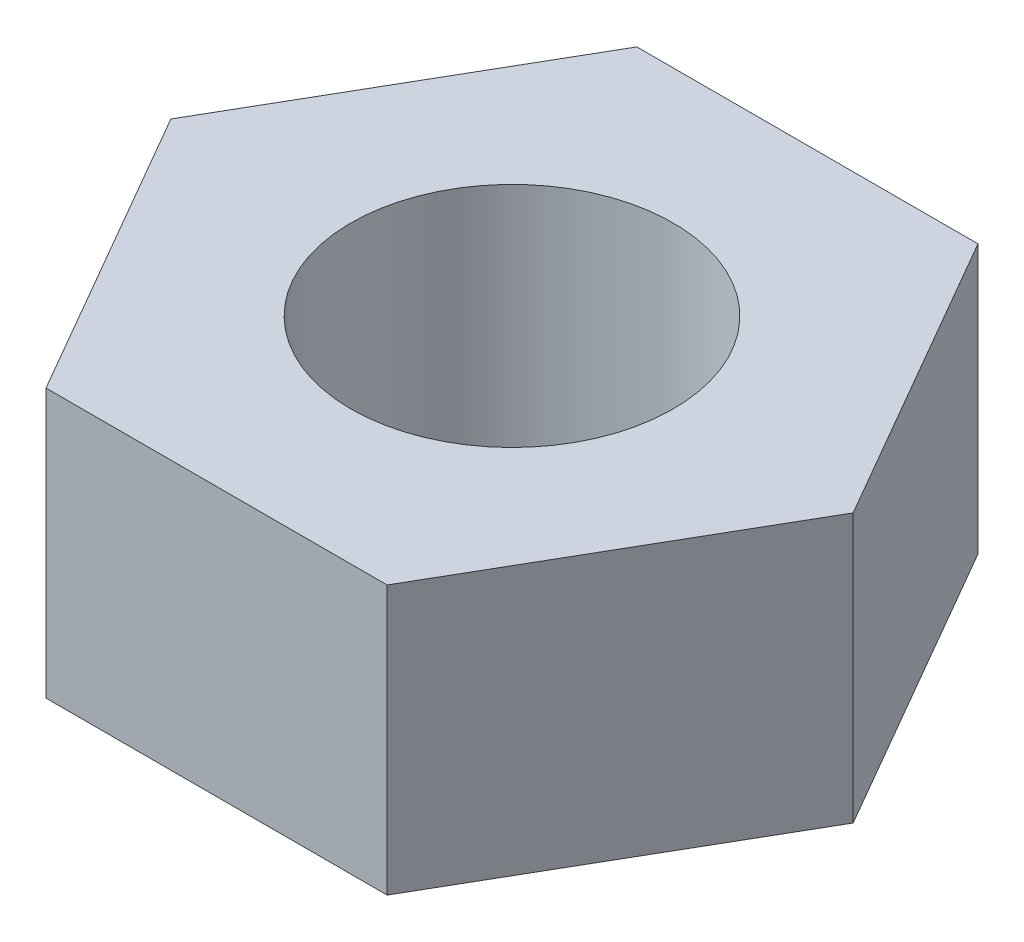
from build123d import *

# Parameters (mm, degrees)
SKETCH1_R           = 1.5
BOSS_EXTRUDE1_DEPTH = 1.25


with BuildPart() as part:
    # Sketch1 → Boss-Extrude1 (new, symmetric)
    with BuildSketch(Plane(origin=(0, 0, 0), x_dir=(1, 0, 0), z_dir=(0, 1, 0))):
        Polygon((1.58771324, 2.75), (-1.58771324, 2.75), (-3.175426481, 0), (-1.58771324, -2.75), (1.58771324, -2.75), (3.175426481, 0), align=None)
        with Locations(Location((0, 0, 0), (0, 0, 270))):
            Circle(SKETCH1_R, mode=Mode.SUBTRACT)
    extrude(amount=BOSS_EXTRUDE1_DEPTH, both=True)


solid = part.part
